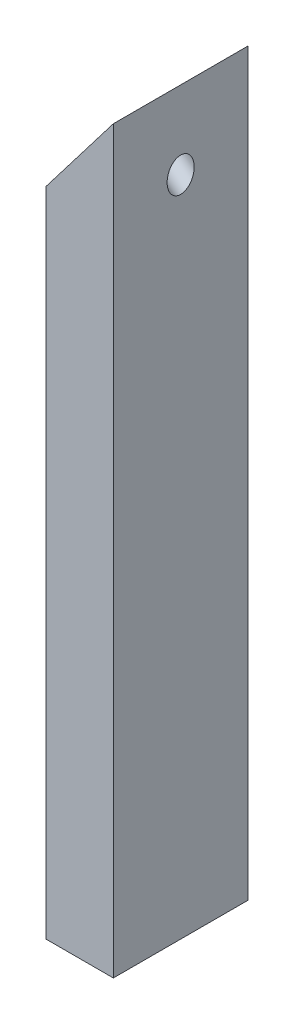
from build123d import *

# Parameters (mm, degrees)
EXTRUDE1_DEPTH              = 25.4
F_1_4_20_TAPPED_HOLE1_D     = 5.1054
F_1_4_20_TAPPED_HOLE1_DEPTH = 16.002
F_1_4_20_TAPPED_HOLE1_TIP   = 1.533816902
F_1_4_20_TAPPED_HOLE2_D     = 5.1054
F_1_4_20_TAPPED_HOLE2_DEPTH = 16.002
F_1_4_20_TAPPED_HOLE2_TIP   = 1.533816902


with BuildPart() as part:
    # Sketch1 → Extrude1 (new body)
    with BuildSketch(Plane.XY):
        Polygon((-6.35, 51.987941466), (6.35, 68.580838747), (6.35, -71.008376889), (-6.35, -71.008376889), align=None)
    extrude(amount=EXTRUDE1_DEPTH)

    # 1/4-20 Tapped Hole1
    with Locations(Plane(origin=(-36.866449815, 12.117365312, 18.061260674), x_dir=(0.6077917109691768, 0.7940964904072809, 0), z_dir=(-0.7940964904072809, 0.6077917109691768, 0))):
        with Locations((59.446155795, 5.361260674)):
            Hole(F_1_4_20_TAPPED_HOLE1_D / 2, depth=F_1_4_20_TAPPED_HOLE1_DEPTH)
            with Locations((0, 0, -(F_1_4_20_TAPPED_HOLE1_DEPTH + F_1_4_20_TAPPED_HOLE1_TIP / 2))):  # 118° drill point
                Cone(0, F_1_4_20_TAPPED_HOLE1_D / 2, F_1_4_20_TAPPED_HOLE1_TIP, mode=Mode.SUBTRACT)

    # 1/4-20 Tapped Hole2
    with Locations(Plane(origin=(-43.242259668, -71.008376889, 18.061260674), x_dir=(-1, 0, 0), z_dir=(0, -1, 0))):
        with Locations((-43.110887349, 5.361260674)):
            Hole(F_1_4_20_TAPPED_HOLE2_D / 2, depth=F_1_4_20_TAPPED_HOLE2_DEPTH)
            with Locations((0, 0, -(F_1_4_20_TAPPED_HOLE2_DEPTH + F_1_4_20_TAPPED_HOLE2_TIP / 2))):  # 118° drill point
                Cone(0, F_1_4_20_TAPPED_HOLE2_D / 2, F_1_4_20_TAPPED_HOLE2_TIP, mode=Mode.SUBTRACT)


solid = part.part
